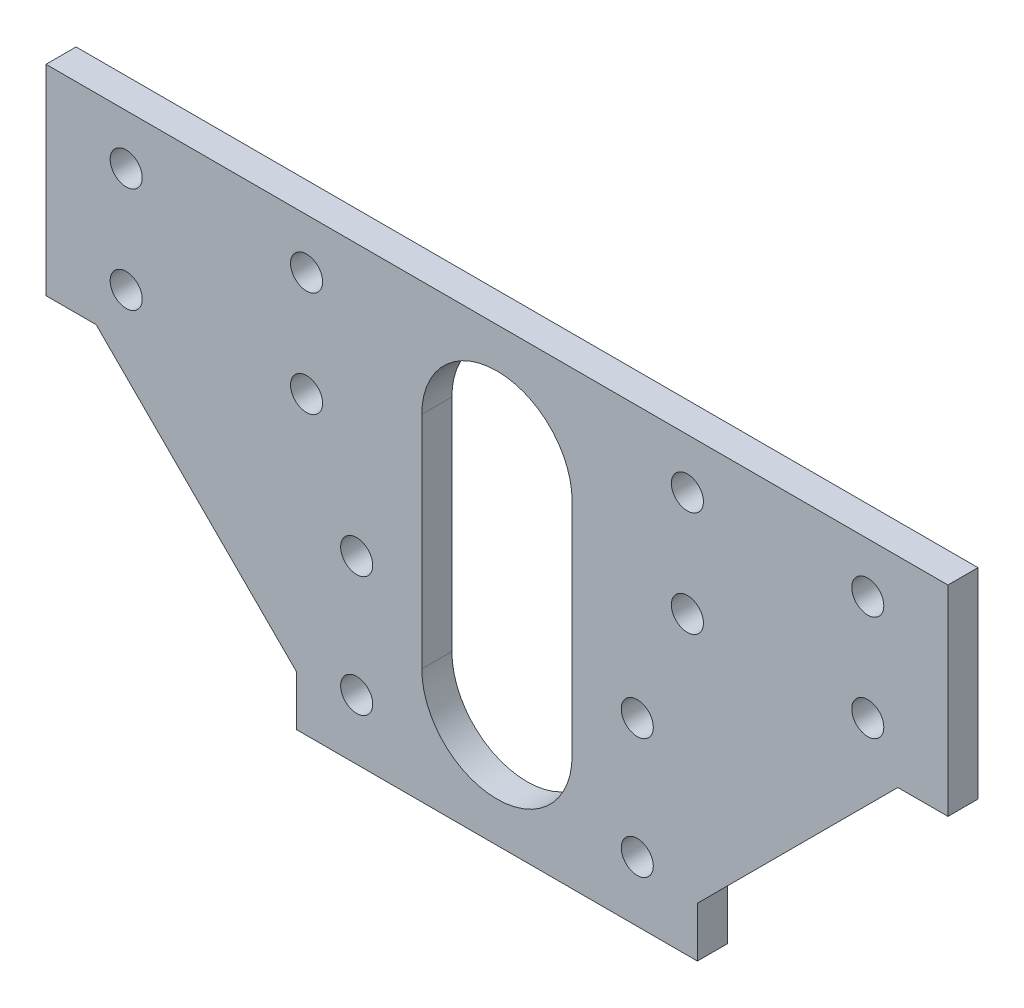
from build123d import *

# Parameters (mm, degrees)
EXTRUDE_1_DEPTH     = 3
SKETCH_2_R          = 1.6
CUT_EXTRUDE_1_DEPTH = 3


with BuildPart() as part:
    # 草图1 → 凸台-拉伸1 (new body)
    with BuildSketch(Plane.XY):
        Polygon((0, 0), (90, 0), (90, -20), (85, -20), (65, -40), (65, -45), (25, -45), (25, -40), (5, -20), (0, -20), align=None)
    extrude(amount=EXTRUDE_1_DEPTH)

    # 草图2 → 切除-拉伸1 (cut)
    with BuildSketch(Plane.XY.offset(3)):
        with Locations((82, -5)):
            Circle(SKETCH_2_R)
        with Locations((82, -15.5)):
            Circle(SKETCH_2_R)
        with Locations((64, -15.5)):
            Circle(SKETCH_2_R)
        with Locations((64, -5)):
            Circle(SKETCH_2_R)
        with Locations((26, -5)):
            Circle(SKETCH_2_R)
        with Locations((26, -15.5)):
            Circle(SKETCH_2_R)
        with Locations((8, -5)):
            Circle(SKETCH_2_R)
        with Locations((8, -15.5)):
            Circle(SKETCH_2_R)
        with Locations((31, -27)):
            Circle(SKETCH_2_R)
        with Locations((31, -39)):
            Circle(SKETCH_2_R)
        with Locations((59, -27)):
            Circle(SKETCH_2_R)
        with Locations((59, -39)):
            Circle(SKETCH_2_R)
        with BuildLine():
            Line((52.5, -11.5), (52.5, -33.5))
            ThreePointArc((52.5, -33.5), (45, -41), (37.5, -33.5))
            Line((37.5, -33.5), (37.5, -11.5))
            ThreePointArc((37.5, -11.5), (45, -4), (52.5, -11.5))
        make_face()
    extrude(amount=-CUT_EXTRUDE_1_DEPTH, mode=Mode.SUBTRACT)


solid = part.part
